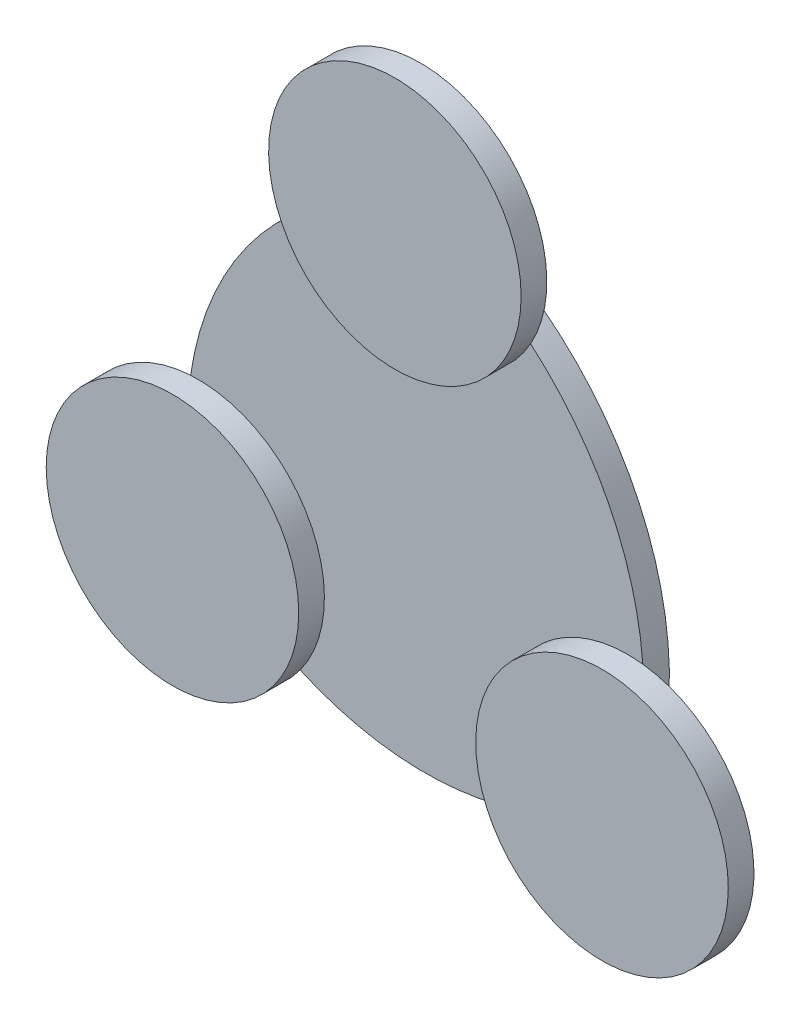
from build123d import *

# Parameters (mm, degrees)
BOSS_EXTRUDE1_DEPTH = 3
SKETCH2_R           = 14.75
BOSS_EXTRUDE2_DEPTH = 3
SKETCH5_R           = 15.25
SKETCH5_R_2         = 14.75
BOSS_EXTRUDE3_DEPTH = 3


with BuildPart() as part:
    # Sketch1 → Boss-Extrude1 (new body)
    with BuildSketch(Plane.XY):
        with BuildLine():
            ThreePointArc((0, 30), (21.984686874, 11.144587301), (24.197417864, -17.733724051))
            ThreePointArc((24.197417864, -17.733724051), (-1.457844914, -26.759103366), (-25.980762114, -15))
            ThreePointArc((-25.980762114, -15), (-22.31018621, 12.880792014), (0, 30))
        make_face()
    extrude(amount=BOSS_EXTRUDE1_DEPTH)

    # Sketch2 → Boss-Extrude2 (add)
    with BuildSketch(Plane.XY.offset(3)):
        with Locations(Location((0, 30, 0), (0, 0, 206.579187248))):
            Circle(SKETCH2_R)
        with Locations(Location((24.197417864, -17.733724051, 0), (0, 0, 209.902892112))):
            Circle(SKETCH2_R)
        with Locations(Location((-25.980762114, -15, 0), (0, 0, 93.420812752))):
            Circle(SKETCH2_R)
    extrude(amount=BOSS_EXTRUDE2_DEPTH)

    # Sketch5 → Boss-Extrude3 (add)
    with BuildSketch(Plane(origin=(0, 0, 0), x_dir=(-1, 0, 0), z_dir=(0, 0, -1))):
        with Locations(Location((0, 0, 0), (0, 0, 180))):
            Circle(SKETCH5_R)
        Circle(SKETCH5_R_2, mode=Mode.SUBTRACT)
    extrude(amount=BOSS_EXTRUDE3_DEPTH)


solid = part.part
